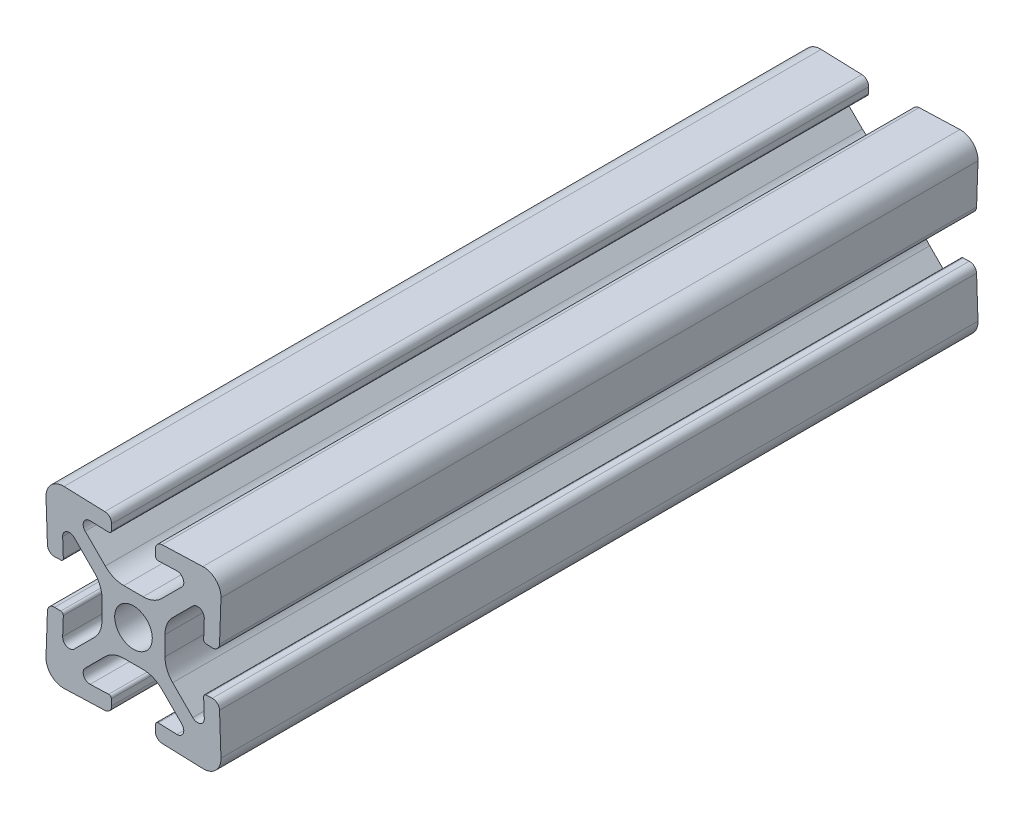
from build123d import *

# Parameters (mm, degrees)
BOSS_EXTRUDE1_DEPTH = 43.265
CIRPATTERN1_COUNT   = 4


with BuildPart() as part:
    # Sketch3 → Boss-Extrude1 (new, symmetric)
    with BuildSketch(Plane.XY):
        with BuildLine():
            Line((-2.524916986, 8.30911066), (-2.500487338, 9.008684239))
            ThreePointArc((-2.500487338, 9.008684239), (-2.714917039, 9.582202525), (-3.272080403, 9.836116498))
            Line((-3.272080403, 9.836116498), (-7.930201007, 9.998781654))
            ThreePointArc((-7.930201007, 9.998781654), (-9.414213562, 9.414213562), (-9.998781654, 7.930201007))
            Line((-9.998781654, 7.930201007), (-9.836116498, 3.272080403))
            ThreePointArc((-9.836116498, 3.272080403), (-9.582202525, 2.714917039), (-9.008684239, 2.500487338))
            Line((-9.008684239, 2.500487338), (-8.30911066, 2.524916986))
            ThreePointArc((-8.30911066, 2.524916986), (-8.100174399, 2.620134726), (-8.019763261, 2.835204083))
            Line((-8.019763261, 2.835204083), (-8.093719461, 4.953032548))
            ThreePointArc((-8.093719461, 4.953032548), (-7.631170264, 5.686128657), (-6.779559917, 5.52444538))
            Line((-6.779559917, 5.52444538), (-4.478679656, 3.22356512))
            ThreePointArc((-4.478679656, 3.22356512), (-3.828361402, 2.250295073), (-3.6, 1.102244776))
            Line((-3.6, 1.102244776), (-3.6, 0))
            Line((-3.6, 0), (-2.15, 0))
            ThreePointArc((-2.15, 0), (-1.52027958, 1.52027958), (0, 2.15))
            Line((0, 2.15), (0, 3.6))
            Line((0, 3.6), (-1.102244776, 3.6))
            ThreePointArc((-1.102244776, 3.6), (-2.250295073, 3.828361402), (-3.22356512, 4.478679656))
            Line((-3.22356512, 4.478679656), (-5.52444538, 6.779559917))
            ThreePointArc((-5.52444538, 6.779559917), (-5.686128657, 7.631170264), (-4.953032548, 8.093719461))
            Line((-4.953032548, 8.093719461), (-2.835204083, 8.019763261))
            ThreePointArc((-2.835204083, 8.019763261), (-2.620134726, 8.100174399), (-2.524916986, 8.30911066))
        make_face()
    boss_extrude1 = extrude(amount=BOSS_EXTRUDE1_DEPTH, both=True)

    # CirPattern1: Boss-Extrude1 ×4 about axis
    cirpattern1_axis = Axis((0, 0, 0), (0, 0, 1))
    for i in range(1, CIRPATTERN1_COUNT):
        add(boss_extrude1.rotate(cirpattern1_axis, i * 360 / CIRPATTERN1_COUNT))


solid = part.part
